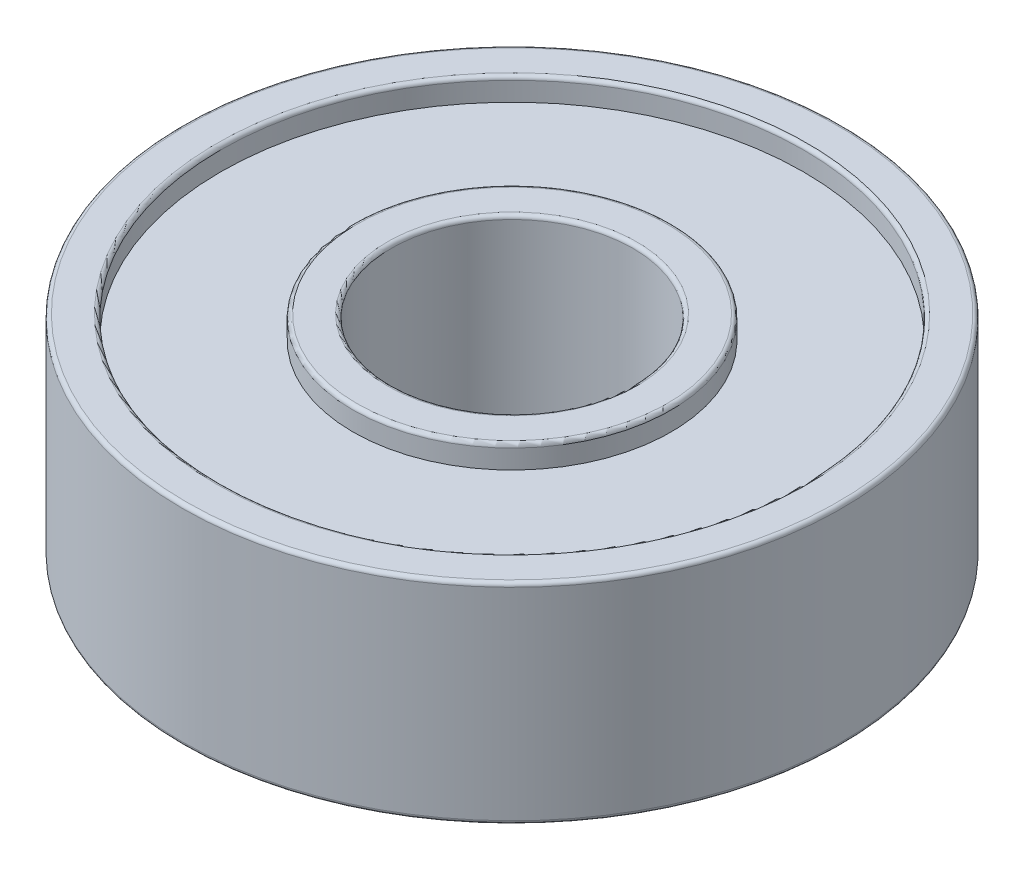
from build123d import *

# Parameters (mm, degrees)
BOSS_EXTRUDE1_DEPTH      = 3.5
BOSS_EXTRUDE1_DEPTH_BACK = 3.5
SKETCH1_R                = 11
SKETCH1_R_2              = 4.0386
SKETCH2_R                = 9.73
SKETCH2_R_2              = 5.3086
CUT_EXTRUDE1_DEPTH       = 0.762
CUT_EXTRUDE2_START       = -0.762
SKETCH3_R                = 9.73
SKETCH3_R_2              = 5.3086
CUT_EXTRUDE2_DEPTH       = 0.762
FILLET1_R                = 0.127


with BuildPart() as part:
    # Sketch1 → Boss-Extrude1 (new, two sides: drawn at the far end of the back side and taken through both)
    with BuildSketch(Plane(origin=(0, 0, 0), x_dir=(1, 0, 0), z_dir=(0, 1, 0)).offset(-BOSS_EXTRUDE1_DEPTH_BACK)):
        Circle(SKETCH1_R)
        Circle(SKETCH1_R_2, mode=Mode.SUBTRACT)
    extrude(amount=BOSS_EXTRUDE1_DEPTH + BOSS_EXTRUDE1_DEPTH_BACK)

    # Sketch2 → Cut-Extrude1 (cut)
    with BuildSketch(Plane(origin=(0, 3.5, 0), x_dir=(1, 0, 0), z_dir=(0, 1, 0))):
        Circle(SKETCH2_R)
        Circle(SKETCH2_R_2, mode=Mode.SUBTRACT)
    extrude(amount=-CUT_EXTRUDE1_DEPTH, mode=Mode.SUBTRACT)

    # Sketch3 → Cut-Extrude2 (cut)
    with BuildSketch(Plane.XZ.offset(3.5).offset(CUT_EXTRUDE2_START)):
        Circle(SKETCH3_R)
        Circle(SKETCH3_R_2, mode=Mode.SUBTRACT)
    extrude(amount=CUT_EXTRUDE2_DEPTH, mode=Mode.SUBTRACT)

    # Fillet1
    fillet1_edges = [part.edges().sort_by_distance(p)[0] for p in [
        (-4.0386, -3.5, 0),
        (-4.0386, 3.5, 0),
        (-5.3086, -3.5, 0),
        (-9.73, -3.5, 0),
        (-11, -3.5, 0),
        (-5.3086, 3.5, 0),
        (-9.73, 3.5, 0),
        (-11, 3.5, 0),
    ]]
    fillet(fillet1_edges, radius=FILLET1_R)


solid = part.part
